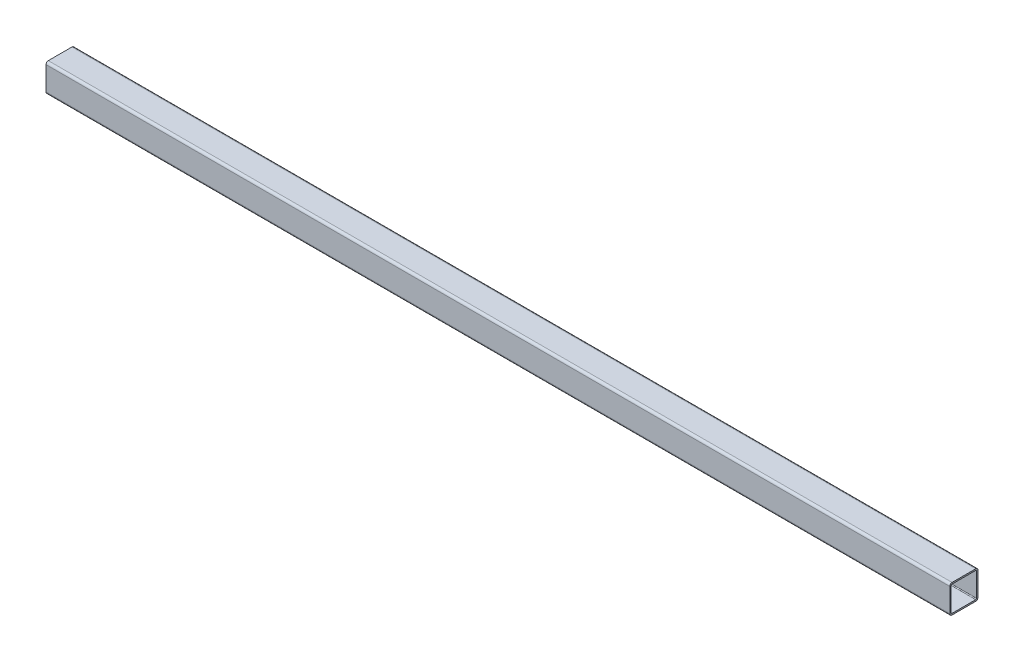
from build123d import *

# Parameters (mm, degrees)
BOSS_EXTRUDE1_DEPTH = 609.6
SCALE1_SCALE_X      = 1
SCALE1_SCALE_Y      = 0.6
SCALE1_SCALE_Z      = 0.6


with BuildPart() as part:
    # Sketch1 → Boss-Extrude1 (new body)
    with BuildSketch(Plane(origin=(0, 0, 0), x_dir=(0, 0, -1), z_dir=(1, 0, 0))):
        with BuildLine():
            Line((-0.186356914, 2.58389064), (-0.186356914, 29.16610936))
            ThreePointArc((-0.186356914, 29.16610936), (-0.94316096, 30.993195953), (-2.770247554, 31.75))
            Line((-2.770247554, 31.75), (-29.352466273, 31.75))
            ThreePointArc((-29.352466273, 31.75), (-31.179552867, 30.993195953), (-31.936356914, 29.16610936))
            Line((-31.936356914, 29.16610936), (-31.936356914, 2.58389064))
            ThreePointArc((-31.936356914, 2.58389064), (-31.179552867, 0.756804047), (-29.352466273, 0))
            Line((-29.352466273, 0), (-2.770247554, 0))
            ThreePointArc((-2.770247554, 0), (-0.94316096, 0.756804047), (-0.186356914, 2.58389064))
        make_face()
        with BuildLine():
            Line((-1.837356914, 2.54), (-1.837356914, 29.208455353))
            ThreePointArc((-1.837356914, 29.208455353), (-2.097737641, 29.838619273), (-2.727901561, 30.099))
            Line((-2.727901561, 30.099), (-29.396356914, 30.099))
            ThreePointArc((-29.396356914, 30.099), (-30.024974842, 29.838617928), (-30.285356914, 29.21))
            Line((-30.285356914, 29.21), (-30.285356914, 2.541544647))
            ThreePointArc((-30.285356914, 2.541544647), (-30.025521588, 1.911927949), (-29.396356914, 1.651))
            Line((-29.396356914, 1.651), (-2.727901561, 1.651))
            ThreePointArc((-2.727901561, 1.651), (-2.098284863, 1.910835326), (-1.837356914, 2.54))
        make_face(mode=Mode.SUBTRACT)
    extrude(amount=BOSS_EXTRUDE1_DEPTH)


with BuildPart() as part_1:
    # Scale1: scaled about (304.8, 15.875, 16.061357084)
    add(part.part.scale((SCALE1_SCALE_X, SCALE1_SCALE_Y, SCALE1_SCALE_Z), about=(304.8, 15.875, 16.061357084)))


solid = part_1.part
